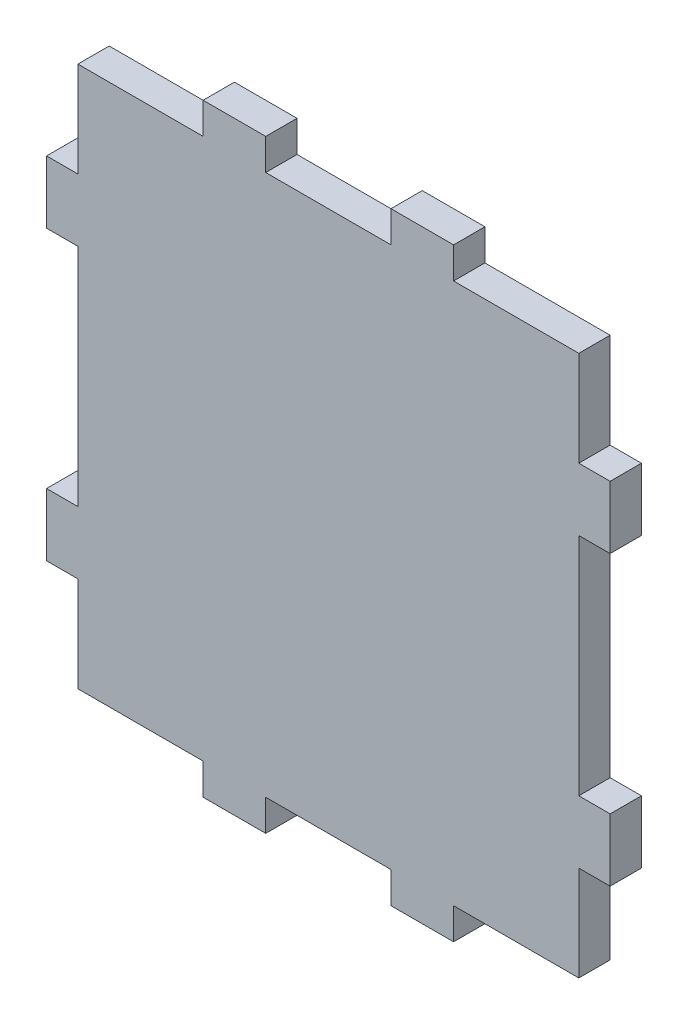
from build123d import *

# Parameters (mm, degrees)
BOSS_EXTRUDE1_DEPTH = 3.175


with BuildPart() as part:
    # Sketch1 → Boss-Extrude1 (new body)
    with BuildSketch(Plane.XY):
        Polygon((19.05, 0), (31.75, 0), (31.75, 3.175), (38.1, 3.175), (38.1, 0), (50.8, 0), (50.8, -9.652), (53.975, -9.652), (53.975, -16.002), (50.8, -16.002), (50.8, -38.862), (53.975, -38.862), (53.975, -45.212), (50.8, -45.212), (50.8, -54.864), (38.1, -54.864), (38.1, -58.039), (31.75, -58.039), (31.75, -54.864), (19.05, -54.864), (19.05, -58.039), (12.7, -58.039), (12.7, -54.864), (0, -54.864), (0, -45.212), (-3.175, -45.212), (-3.175, -38.862), (0, -38.862), (0, -16.002), (-3.175, -16.002), (-3.175, -9.652), (0, -9.652), (0, 0), (12.7, 0), (12.7, 3.175), (19.05, 3.175), align=None)
    extrude(amount=BOSS_EXTRUDE1_DEPTH)


solid = part.part
